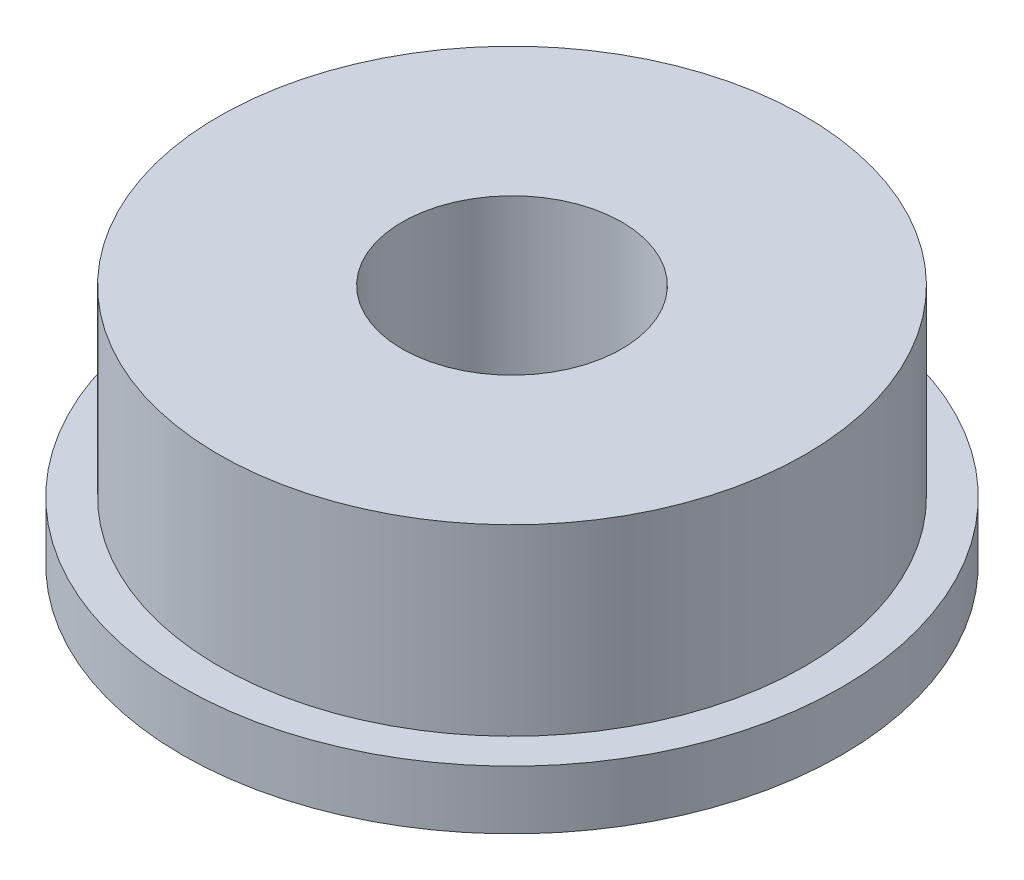
from build123d import *

# Parameters (mm, degrees)
SKETCH1_R           = 4.5
BOSS_EXTRUDE1_DEPTH = 0.8
SKETCH2_R           = 4
BOSS_EXTRUDE2_DEPTH = 2.5
SKETCH3_R           = 1.5
CUT_EXTRUDE1_DEPTH  = 12.5


with BuildPart() as part:
    # Sketch1 → Boss-Extrude1 (new body)
    with BuildSketch(Plane(origin=(0, 0, 0), x_dir=(1, 0, 0), z_dir=(0, 1, 0))):
        with Locations(Location((0, 0, 0), (0, 0, 270))):
            Circle(SKETCH1_R)
    extrude(amount=BOSS_EXTRUDE1_DEPTH)

    # Sketch2 → Boss-Extrude2 (add)
    with BuildSketch(Plane(origin=(0, 0.8, 0), x_dir=(-1, 0, 0), z_dir=(0, -1, 0))):
        with Locations(Location((0, 0, 0), (0, 0, 180))):
            Circle(SKETCH2_R)
    extrude(amount=-BOSS_EXTRUDE2_DEPTH)

    # Sketch3 → Cut-Extrude1 (cut)
    with BuildSketch(Plane(origin=(0, 0, 0), x_dir=(1, 0, 0), z_dir=(0, 1, 0))):
        with Locations(Location((0, 0, 0), (0, 0, 90))):
            Circle(SKETCH3_R)
    extrude(amount=CUT_EXTRUDE1_DEPTH, mode=Mode.SUBTRACT)


solid = part.part
